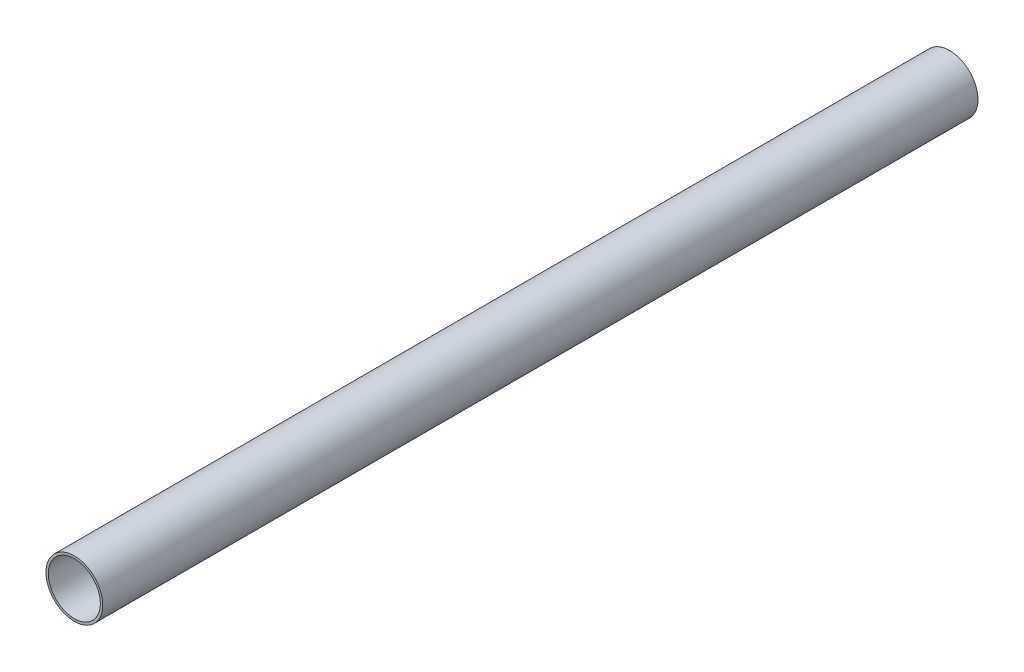
from build123d import *

# Parameters (mm, degrees)
IZIM1_R                     = 12
IZIM1_R_2                   = 11
Y_KSEKLIK_EKSTR_ZYON1_DEPTH = 370


with BuildPart() as part:
    # Çizim1 → Yükseklik-Ekstrüzyon1 (new body)
    with BuildSketch(Plane.XY):
        Circle(IZIM1_R)
        Circle(IZIM1_R_2, mode=Mode.SUBTRACT)
    extrude(amount=Y_KSEKLIK_EKSTR_ZYON1_DEPTH)


solid = part.part
